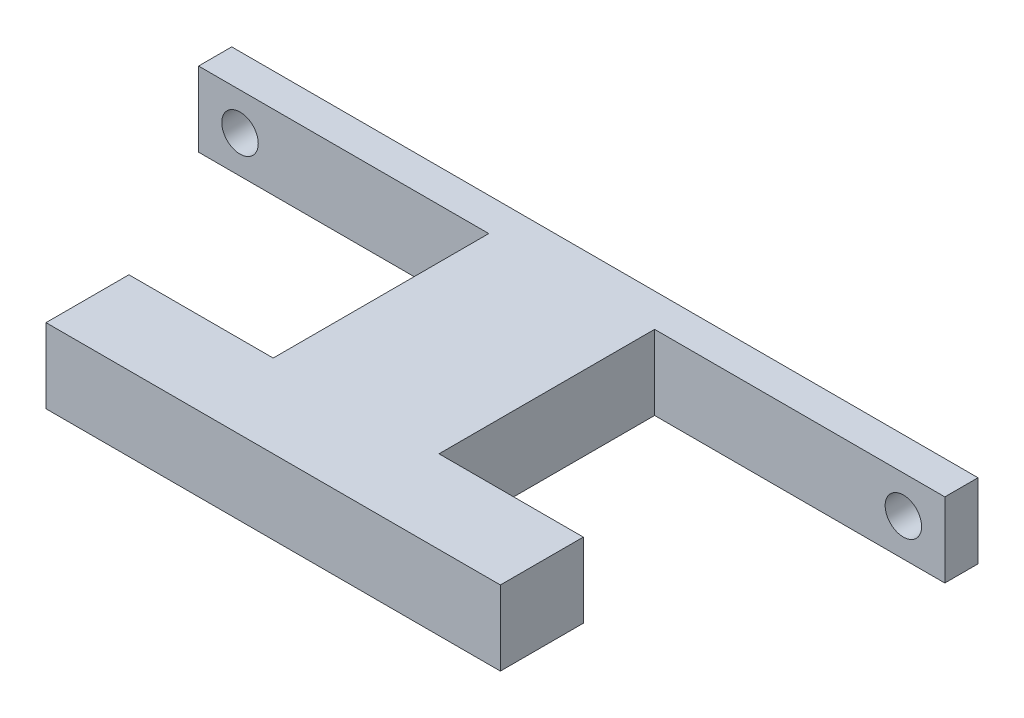
from build123d import *

# Parameters (mm, degrees)
SKETCH1_R           = 2.794
BOSS_EXTRUDE1_DEPTH = 5.08
SKETCH3_W           = 25.4
SKETCH3_H           = 11.43
BOSS_EXTRUDE2_DEPTH = 45.72
SKETCH4_W           = 22.096687199
SKETCH4_H           = 11.43
BOSS_EXTRUDE3_DEPTH = 12.7


with BuildPart() as part:
    # Sketch1 → Boss-Extrude1 (new body)
    with BuildSketch(Plane.XY):
        Polygon((-57.15, 2.54), (-57.15, -2.54), (-57.15, -5.715), (57.15, -5.715), (57.15, -2.54), (57.15, 2.54), (57.15, 5.715), (-57.15, 5.715), align=None)
        with Locations((50.8, 0)):
            Circle(SKETCH1_R, mode=Mode.SUBTRACT)
        with Locations((-50.8, 0)):
            Circle(SKETCH1_R, mode=Mode.SUBTRACT)
    extrude(amount=BOSS_EXTRUDE1_DEPTH)

    # Sketch3 → Boss-Extrude2 (add)
    with BuildSketch(Plane.XY.offset(5.08)):
        Rectangle(SKETCH3_W, SKETCH3_H)
    extrude(amount=BOSS_EXTRUDE2_DEPTH)

    # Sketch4 → Boss-Extrude3 (add)
    with BuildSketch(Plane.XY.offset(50.8)):
        with Locations((23.7483436, 0)):
            Rectangle(SKETCH4_W, SKETCH4_H)
        with Locations((-23.7483436, 0)):
            Rectangle(SKETCH4_W, SKETCH4_H)
    extrude(amount=-BOSS_EXTRUDE3_DEPTH)


solid = part.part
